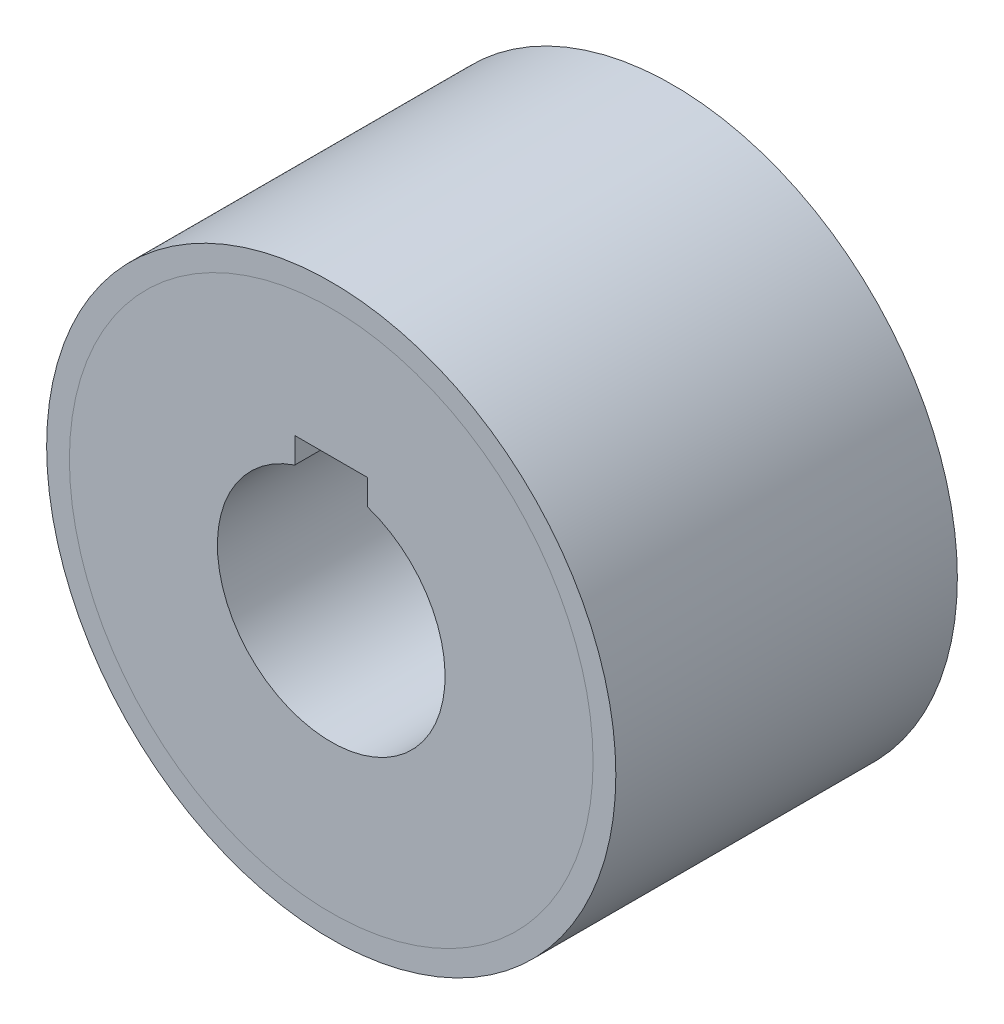
from build123d import *

# Parameters (mm, degrees)
SKETCH1_R           = 57.5
BOSS_EXTRUDE1_DEPTH = 75
SKETCH2_R           = 25
CUT_EXTRUDE1_DEPTH  = 111.623234449
CUT_EXTRUDE2_DEPTH  = 111.623234449
SKETCH4_R           = 62.5
SKETCH4_R_2         = 57.5
BOSS_EXTRUDE3_DEPTH = 75


with BuildPart() as part:
    # Sketch1 → Boss-Extrude1 (new body)
    with BuildSketch(Plane.XY):
        Circle(SKETCH1_R)
    extrude(amount=BOSS_EXTRUDE1_DEPTH)

    # Sketch2 → Cut-Extrude1 (cut, through all)
    with BuildSketch(Plane.XY.offset(75)):
        Circle(SKETCH2_R)
    extrude(amount=-CUT_EXTRUDE1_DEPTH, mode=Mode.SUBTRACT)

    # Sketch3 → Cut-Extrude2 (cut, through all)
    with BuildSketch(Plane.XY.offset(75)):
        with BuildLine():
            Line((-8, 23.685438565), (-8, 29.3))
            Line((-8, 29.3), (8, 29.3))
            Line((8, 29.3), (8, 23.685438565))
            ThreePointArc((8, 23.685438565), (0, 25), (-8, 23.685438565))
        make_face()
    extrude(amount=-CUT_EXTRUDE2_DEPTH, mode=Mode.SUBTRACT)


with BuildPart() as body_2:
    # Sketch4 → Boss-Extrude3 (new body)
    with BuildSketch(Plane.XY.offset(75)):
        Circle(SKETCH4_R)
        Circle(SKETCH4_R_2, mode=Mode.SUBTRACT)
    extrude(amount=-BOSS_EXTRUDE3_DEPTH)


solid = Compound([part.part, body_2.part])
